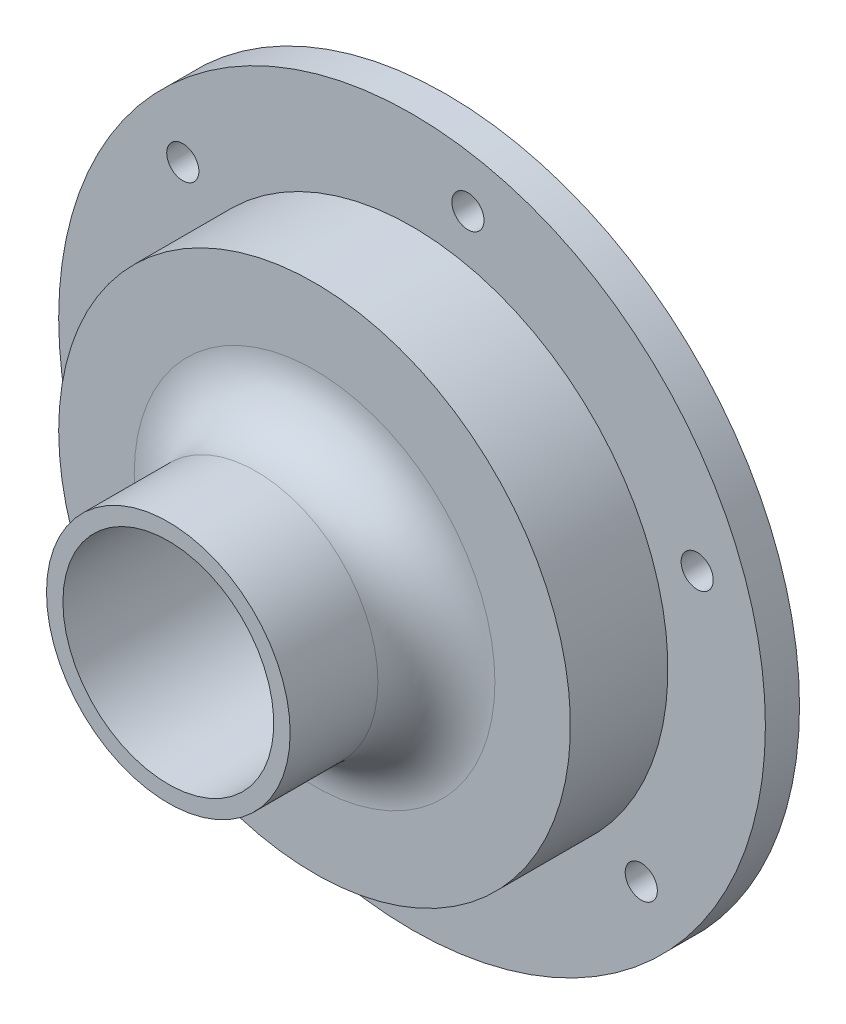
from build123d import *

# Parameters (mm, degrees)
FILLET1_R                               = 12
CBORE_FOR_M6_HEX_HEAD_BOLT1_D           = 6.6
CBORE_FOR_M6_HEX_HEAD_BOLT1_CBORE_D     = 14.547
CBORE_FOR_M6_HEX_HEAD_BOLT1_CBORE_DEPTH = 1
CIRPATTERN1_COUNT                       = 6


with BuildPart() as part:
    # Sketch2 → Revolve1 (revolve)
    with BuildSketch(Plane(origin=(0, 0, 0), x_dir=(1, 0, 0), z_dir=(0, 1, 0))):
        Polygon((-72.5, 0), (-72.5, -7), (-52.5, -7), (-52.5, -27), (-25, -27), (-25, -57), (-21.63, -57), (-21.63, 0), align=None)
    revolve(axis=Axis((0, 0, 0), (0, 0, 1)))

    # Fillet1
    fillet1_edges = [part.edges().sort_by_distance(p)[0] for p in [
        (25, 0, 27),
    ]]
    fillet(fillet1_edges, radius=FILLET1_R)

    # CBORE for M6 Hex Head Bolt1 (through all)
    with Locations(Plane(origin=(-47.031359199, 40.398654085, 0), x_dir=(-1, 0, 0), z_dir=(0, 0, -1))):
        with Locations((0, 0)):
            cbore_for_m6_hex_head_bolt1 = CounterBoreHole(CBORE_FOR_M6_HEX_HEAD_BOLT1_D / 2, CBORE_FOR_M6_HEX_HEAD_BOLT1_CBORE_D / 2, CBORE_FOR_M6_HEX_HEAD_BOLT1_CBORE_DEPTH)

    # CirPattern1: CBORE for M6 Hex Head Bolt1 ×6 about axis
    cirpattern1_axis = Axis((0, 0, 0), (0, 0, 1))
    for i in range(1, CIRPATTERN1_COUNT):
        add(cbore_for_m6_hex_head_bolt1.rotate(cirpattern1_axis, i * 360 / CIRPATTERN1_COUNT), mode=Mode.SUBTRACT)


solid = part.part
